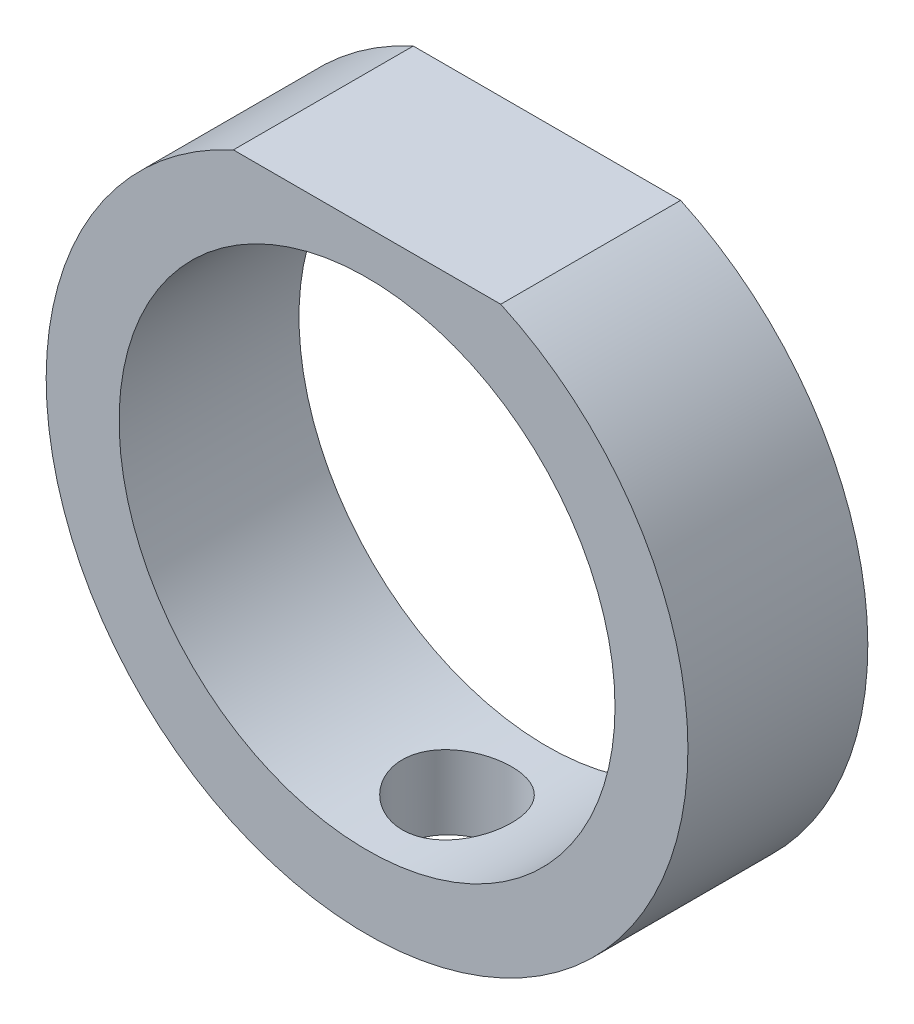
from build123d import *

# Parameters (mm, degrees)
SKETCH1_R           = 10.2
BOSS_EXTRUDE1_DEPTH = 7.4
SKETCH2_R           = 2.25
CUT_EXTRUDE1_DEPTH  = 21.080836636


with BuildPart() as part:
    # Sketch1 → Boss-Extrude1 (new body)
    with BuildSketch(Plane.XY):
        with BuildLine():
            Line((5.499090834, 12), (-5.499090834, 12))
            ThreePointArc((-5.499090834, 12), (0, -13.2), (5.499090834, 12))
        make_face()
        Circle(SKETCH1_R, mode=Mode.SUBTRACT)
    extrude(amount=BOSS_EXTRUDE1_DEPTH)

    # Sketch2 → Cut-Extrude1 (cut, through all)
    with BuildSketch(Plane(origin=(0, 0, 0), x_dir=(1, 0, 0), z_dir=(0, 1, 0))):
        with Locations(Location((0, -3.7, 0), (0, 0, 270))):
            Circle(SKETCH2_R)
    extrude(amount=-CUT_EXTRUDE1_DEPTH, mode=Mode.SUBTRACT)


solid = part.part
